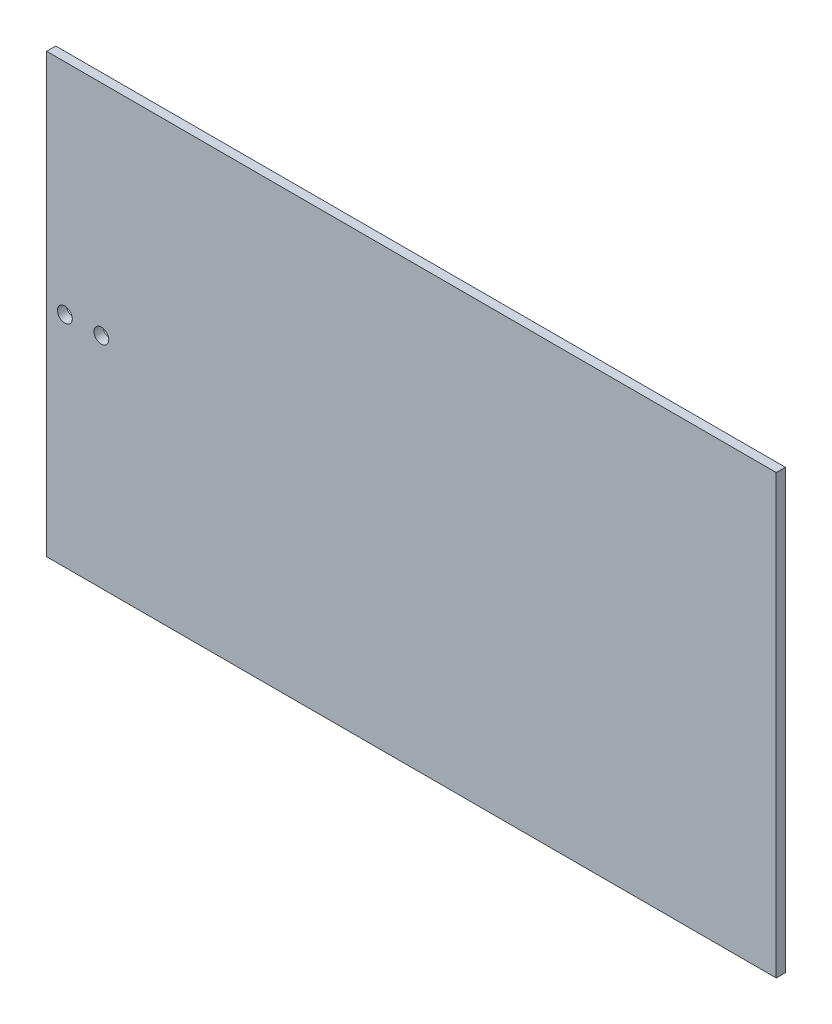
from build123d import *

# Parameters (mm, degrees)
SKETCH1_W           = 254
SKETCH1_H           = 152.4
BOSS_EXTRUDE1_DEPTH = 3.175
SKETCH2_R           = 2.5796875
CUT_EXTRUDE1_DEPTH  = 3.175


with BuildPart() as part:
    # Sketch1 → Boss-Extrude1 (new body)
    with BuildSketch(Plane.XY):
        with Locations((-31.865425678, -11.229473684)):
            Rectangle(SKETCH1_W, SKETCH1_H)
    extrude(amount=BOSS_EXTRUDE1_DEPTH)

    # Sketch2 → Cut-Extrude1 (cut)
    with BuildSketch(Plane.XY.offset(3.175)):
        with Locations((-152.515425678, -11.229473684)):
            Circle(SKETCH2_R)
        with Locations((-139.815425678, -11.229473684)):
            Circle(SKETCH2_R)
    extrude(amount=-CUT_EXTRUDE1_DEPTH, mode=Mode.SUBTRACT)


solid = part.part
